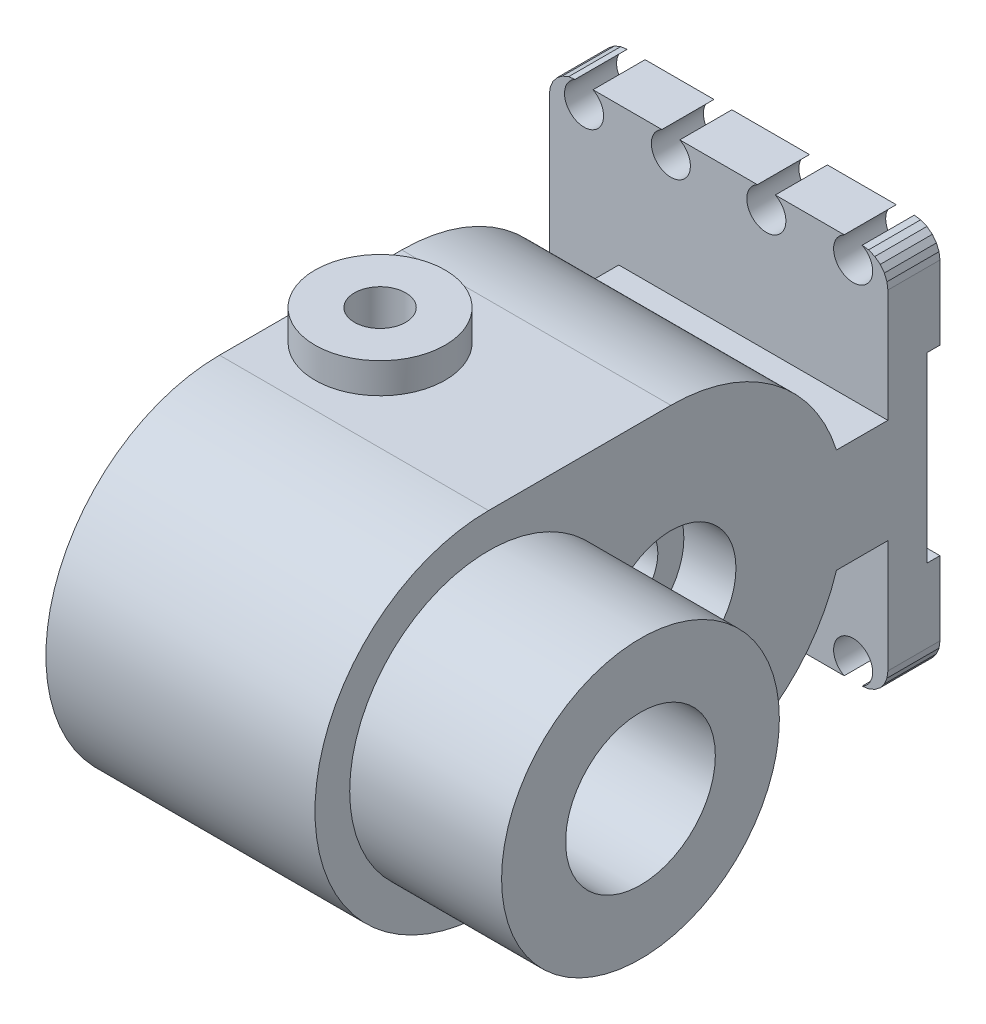
from build123d import *

# Parameters (mm, degrees)
F_01_HOUSING_DEPTH        = 62
SKETCH_2_W                = 50
SKETCH_2_H                = 24
F_02_COLUMN_DEPTH         = 62
F_03_BASE_DEPTH           = 12
SKETCH_4_R                = 32
F_04_SBOX_DEPTH           = 35
SKETCH_5_R                = 24
F_05_CAV_UP_DEPTH         = 30
SKETCH_6_R                = 9
F_06_BRG_UP_DEPTH         = 20
SKETCH_7_R                = 13
F_07_PACK_UP_DEPTH        = 22
SKETCH_8_R                = 17.25
F_08_M36_UP_DEPTH         = 25
SKETCH_9_R                = 24
F_09_CAV_LO_DEPTH         = 30
SKETCH_10_R               = 9
F_10_BRG_LO_DEPTH         = 20
SKETCH_11_R               = 15
F_11_RECESS_LO_DEPTH      = 12
SKETCH_12_R               = 15
F_12_PORTBOSS_P_DEPTH     = 17
SKETCH_13_R               = 10
F_13_PASS_P_DEPTH         = 25
SKETCH_14_R               = 5.9
F_14_G14_P_DEPTH          = 14
F_12_PORTBOSS_N_START     = -17
SKETCH_15_R               = 15
F_12_PORTBOSS_N_DEPTH     = 17
F_13_PASS_N_START         = 25
SKETCH_16_R               = 10
F_13_PASS_N_DEPTH         = 25
F_14_G14_N_START          = 14
SKETCH_17_R               = 5.9
F_14_G14_N_DEPTH          = 14
SKETCH_18_R               = 2.5
CUT_EXTRUDE_15_M6_0_DEPTH = 10
SKETCH_19_R               = 2.5
CUT_EXTRUDE_15_M6_1_DEPTH = 10
SKETCH_20_R               = 2.5
CUT_EXTRUDE_15_M6_2_DEPTH = 10
SKETCH_21_R               = 2.5
CUT_EXTRUDE_15_M6_3_DEPTH = 10
SKETCH_22_R               = 2.5
CUT_EXTRUDE_15_M6_4_DEPTH = 10
SKETCH_23_R               = 2.5
CUT_EXTRUDE_15_M6_5_DEPTH = 10
SKETCH_24_R               = 2.5
F_16_DOWEL_0_DEPTH        = 12
SKETCH_25_R               = 2.5
F_16_DOWEL_1_DEPTH        = 12
SKETCH_26_R               = 4.5
F_17_BH_00_DEPTH          = 14
SKETCH_27_R               = 4.5
F_17_BH_01_DEPTH          = 14
SKETCH_28_R               = 4.5
F_17_BH_10_DEPTH          = 14
SKETCH_29_R               = 4.5
F_17_BH_11_DEPTH          = 14
SKETCH_30_R               = 4.5
F_17_BH_20_DEPTH          = 14
SKETCH_31_R               = 4.5
F_17_BH_21_DEPTH          = 14
SKETCH_32_R               = 4.5
F_17_BH_30_DEPTH          = 14
SKETCH_33_R               = 4.5
F_17_BH_31_DEPTH          = 14
SKETCH_34_W               = 78
SKETCH_34_H               = 42
F_18_RELIEF_DEPTH         = 4


with BuildPart() as part:
    # 草图1 → 01_HOUSING (new body)
    with BuildSketch(Plane(origin=(-30, 0, 0), x_dir=(0, 0, -1), z_dir=(1, 0, 0))):
        with BuildLine():
            Line((-104, -40), (-62, -40))
            ThreePointArc((-62, -40), (-22, 0), (-62, 40))
            Line((-62, 40), (-104, 40))
            ThreePointArc((-104, 40), (-144, 0), (-104, -40))
        make_face()
    extrude(amount=F_01_HOUSING_DEPTH)

    # 草图2 → 02_COLUMN (add)
    with BuildSketch(Plane(origin=(-30, 0, 0), x_dir=(0, 0, -1), z_dir=(1, 0, 0))):
        with Locations((-37, 0)):
            Rectangle(SKETCH_2_W, SKETCH_2_H)
    extrude(amount=F_02_COLUMN_DEPTH)

    # 草图3 → 03_BASE (add)
    with BuildSketch(Plane.XY):
        Polygon((26, -44), (27.552914271, -43.795554958), (29, -43.196152423), (30.242640687, -42.242640687), (31.196152423, -41), (31.795554958, -39.552914271), (32, -38), (32, 38), (31.795554958, 39.552914271), (31.196152423, 41), (30.242640687, 42.242640687), (29, 43.196152423), (27.552914271, 43.795554958), (26, 44), (-40, 44), (-41.552914271, 43.795554958), (-43, 43.196152423), (-44.242640687, 42.242640687), (-45.196152423, 41), (-45.795554958, 39.552914271), (-46, 38), (-46, -38), (-45.795554958, -39.552914271), (-45.196152423, -41), (-44.242640687, -42.242640687), (-43, -43.196152423), (-41.552914271, -43.795554958), (-40, -44), align=None)
    extrude(amount=F_03_BASE_DEPTH)

    # 草图4 → 04_SBOX (add)
    with BuildSketch(Plane(origin=(32, 0, 0), x_dir=(0, 0, -1), z_dir=(1, 0, 0))):
        with Locations((-104, 0)):
            Circle(SKETCH_4_R)
    extrude(amount=F_04_SBOX_DEPTH)

    # 草图5 → 05_CAV_UP (cut)
    with BuildSketch(Plane(origin=(-30, 0, 0), x_dir=(0, 0, -1), z_dir=(1, 0, 0))):
        with Locations((-104, 0)):
            Circle(SKETCH_5_R)
    extrude(amount=F_05_CAV_UP_DEPTH, mode=Mode.SUBTRACT)

    # 草图6 → 06_BRG_UP (cut)
    with BuildSketch(Plane(origin=(0, 0, 0), x_dir=(0, 0, -1), z_dir=(1, 0, 0))):
        with Locations((-104, 0)):
            Circle(SKETCH_6_R)
    extrude(amount=F_06_BRG_UP_DEPTH, mode=Mode.SUBTRACT)

    # 草图7 → 07_PACK_UP (cut)
    with BuildSketch(Plane(origin=(20, 0, 0), x_dir=(0, 0, -1), z_dir=(1, 0, 0))):
        with Locations((-104, 0)):
            Circle(SKETCH_7_R)
    extrude(amount=F_07_PACK_UP_DEPTH, mode=Mode.SUBTRACT)

    # 草图8 → 08_M36_UP (cut)
    with BuildSketch(Plane(origin=(42, 0, 0), x_dir=(0, 0, -1), z_dir=(1, 0, 0))):
        with Locations((-104, 0)):
            Circle(SKETCH_8_R)
    extrude(amount=F_08_M36_UP_DEPTH, mode=Mode.SUBTRACT)

    # 草图9 → 09_CAV_LO (cut)
    with BuildSketch(Plane(origin=(-30, 0, 0), x_dir=(0, 0, -1), z_dir=(1, 0, 0))):
        with Locations((-62, 0)):
            Circle(SKETCH_9_R)
    extrude(amount=F_09_CAV_LO_DEPTH, mode=Mode.SUBTRACT)

    # 草图10 → 10_BRG_LO (cut)
    with BuildSketch(Plane(origin=(0, 0, 0), x_dir=(0, 0, -1), z_dir=(1, 0, 0))):
        with Locations((-62, 0)):
            Circle(SKETCH_10_R)
    extrude(amount=F_10_BRG_LO_DEPTH, mode=Mode.SUBTRACT)

    # 草图11 → 11_RECESS_LO (cut)
    with BuildSketch(Plane(origin=(20, 0, 0), x_dir=(0, 0, -1), z_dir=(1, 0, 0))):
        with Locations((-62, 0)):
            Circle(SKETCH_11_R)
    extrude(amount=F_11_RECESS_LO_DEPTH, mode=Mode.SUBTRACT)

    # 草图12 → 12_PORTBOSS_P (add)
    with BuildSketch(Plane(origin=(0, 30, 0), x_dir=(1, 0, 0), z_dir=(0, 1, 0))):
        with Locations((-14, -83)):
            Circle(SKETCH_12_R)
    extrude(amount=F_12_PORTBOSS_P_DEPTH)

    # 草图13 → 13_PASS_P (cut)
    with BuildSketch(Plane(origin=(0, 33, 0), x_dir=(1, 0, 0), z_dir=(0, 1, 0))):
        with Locations((-14, -83)):
            Circle(SKETCH_13_R)
    extrude(amount=-F_13_PASS_P_DEPTH, mode=Mode.SUBTRACT)

    # 草图14 → 14_G14_P (cut)
    with BuildSketch(Plane(origin=(0, 47, 0), x_dir=(1, 0, 0), z_dir=(0, 1, 0))):
        with Locations((-14, -83)):
            Circle(SKETCH_14_R)
    extrude(amount=-F_14_G14_P_DEPTH, mode=Mode.SUBTRACT)

    # 草图15 → 12_PORTBOSS_N (add)
    with BuildSketch(Plane(origin=(0, -30, 0), x_dir=(1, 0, 0), z_dir=(0, 1, 0)).offset(F_12_PORTBOSS_N_START)):
        with Locations((-14, -83)):
            Circle(SKETCH_15_R)
    extrude(amount=F_12_PORTBOSS_N_DEPTH)

    # 草图16 → 13_PASS_N (cut)
    with BuildSketch(Plane(origin=(0, -33, 0), x_dir=(1, 0, 0), z_dir=(0, 1, 0)).offset(F_13_PASS_N_START)):
        with Locations((-14, -83)):
            Circle(SKETCH_16_R)
    extrude(amount=-F_13_PASS_N_DEPTH, mode=Mode.SUBTRACT)

    # 草图17 → 14_G14_N (cut)
    with BuildSketch(Plane(origin=(0, -47, 0), x_dir=(1, 0, 0), z_dir=(0, 1, 0)).offset(F_14_G14_N_START)):
        with Locations((-14, -83)):
            Circle(SKETCH_17_R)
    extrude(amount=-F_14_G14_N_DEPTH, mode=Mode.SUBTRACT)

    # 草图18 → 15_M6_0 (cut)
    with BuildSketch(Plane(origin=(-30, 0, 0), x_dir=(0, 0, -1), z_dir=(1, 0, 0))):
        with Locations((-104, 32)):
            Circle(SKETCH_18_R)
    extrude(amount=CUT_EXTRUDE_15_M6_0_DEPTH, mode=Mode.SUBTRACT)

    # 草图19 → 15_M6_1 (cut)
    with BuildSketch(Plane(origin=(-30, 0, 0), x_dir=(0, 0, -1), z_dir=(1, 0, 0))):
        with Locations((-104, -32)):
            Circle(SKETCH_19_R)
    extrude(amount=CUT_EXTRUDE_15_M6_1_DEPTH, mode=Mode.SUBTRACT)

    # 草图20 → 15_M6_2 (cut)
    with BuildSketch(Plane(origin=(-30, 0, 0), x_dir=(0, 0, -1), z_dir=(1, 0, 0))):
        with Locations((-62, 32)):
            Circle(SKETCH_20_R)
    extrude(amount=CUT_EXTRUDE_15_M6_2_DEPTH, mode=Mode.SUBTRACT)

    # 草图21 → 15_M6_3 (cut)
    with BuildSketch(Plane(origin=(-30, 0, 0), x_dir=(0, 0, -1), z_dir=(1, 0, 0))):
        with Locations((-62, -32)):
            Circle(SKETCH_21_R)
    extrude(amount=CUT_EXTRUDE_15_M6_3_DEPTH, mode=Mode.SUBTRACT)

    # 草图22 → 15_M6_4 (cut)
    with BuildSketch(Plane(origin=(-30, 0, 0), x_dir=(0, 0, -1), z_dir=(1, 0, 0))):
        with Locations((-136, 0)):
            Circle(SKETCH_22_R)
    extrude(amount=CUT_EXTRUDE_15_M6_4_DEPTH, mode=Mode.SUBTRACT)

    # 草图23 → 15_M6_5 (cut)
    with BuildSketch(Plane(origin=(-30, 0, 0), x_dir=(0, 0, -1), z_dir=(1, 0, 0))):
        with Locations((-30, 0)):
            Circle(SKETCH_23_R)
    extrude(amount=CUT_EXTRUDE_15_M6_5_DEPTH, mode=Mode.SUBTRACT)

    # 草图24 → 16_DOWEL_0 (cut)
    with BuildSketch(Plane(origin=(-30, 0, 0), x_dir=(0, 0, -1), z_dir=(1, 0, 0))):
        with Locations((-126.6, 22.6)):
            Circle(SKETCH_24_R)
    extrude(amount=F_16_DOWEL_0_DEPTH, mode=Mode.SUBTRACT)

    # 草图25 → 16_DOWEL_1 (cut)
    with BuildSketch(Plane(origin=(-30, 0, 0), x_dir=(0, 0, -1), z_dir=(1, 0, 0))):
        with Locations((-39.4, -22.6)):
            Circle(SKETCH_25_R)
    extrude(amount=F_16_DOWEL_1_DEPTH, mode=Mode.SUBTRACT)

    # 草图26 → 17_BH_00 (cut)
    with BuildSketch(Plane.XY.offset(-1)):
        with Locations((-38, 40)):
            Circle(SKETCH_26_R)
    extrude(amount=F_17_BH_00_DEPTH, mode=Mode.SUBTRACT)

    # 草图27 → 17_BH_01 (cut)
    with BuildSketch(Plane.XY.offset(-1)):
        with Locations((-38, -40)):
            Circle(SKETCH_27_R)
    extrude(amount=F_17_BH_01_DEPTH, mode=Mode.SUBTRACT)

    # 草图28 → 17_BH_10 (cut)
    with BuildSketch(Plane.XY.offset(-1)):
        with Locations((-18, 40)):
            Circle(SKETCH_28_R)
    extrude(amount=F_17_BH_10_DEPTH, mode=Mode.SUBTRACT)

    # 草图29 → 17_BH_11 (cut)
    with BuildSketch(Plane.XY.offset(-1)):
        with Locations((-18, -40)):
            Circle(SKETCH_29_R)
    extrude(amount=F_17_BH_11_DEPTH, mode=Mode.SUBTRACT)

    # 草图30 → 17_BH_20 (cut)
    with BuildSketch(Plane.XY.offset(-1)):
        with Locations((4, 40)):
            Circle(SKETCH_30_R)
    extrude(amount=F_17_BH_20_DEPTH, mode=Mode.SUBTRACT)

    # 草图31 → 17_BH_21 (cut)
    with BuildSketch(Plane.XY.offset(-1)):
        with Locations((4, -40)):
            Circle(SKETCH_31_R)
    extrude(amount=F_17_BH_21_DEPTH, mode=Mode.SUBTRACT)

    # 草图32 → 17_BH_30 (cut)
    with BuildSketch(Plane.XY.offset(-1)):
        with Locations((24, 40)):
            Circle(SKETCH_32_R)
    extrude(amount=F_17_BH_30_DEPTH, mode=Mode.SUBTRACT)

    # 草图33 → 17_BH_31 (cut)
    with BuildSketch(Plane.XY.offset(-1)):
        with Locations((24, -40)):
            Circle(SKETCH_33_R)
    extrude(amount=F_17_BH_31_DEPTH, mode=Mode.SUBTRACT)

    # 草图34 → 18_RELIEF (cut)
    with BuildSketch(Plane.XY.offset(-1)):
        with Locations((-7, 0)):
            Rectangle(SKETCH_34_W, SKETCH_34_H)
    extrude(amount=F_18_RELIEF_DEPTH, mode=Mode.SUBTRACT)


solid = part.part
